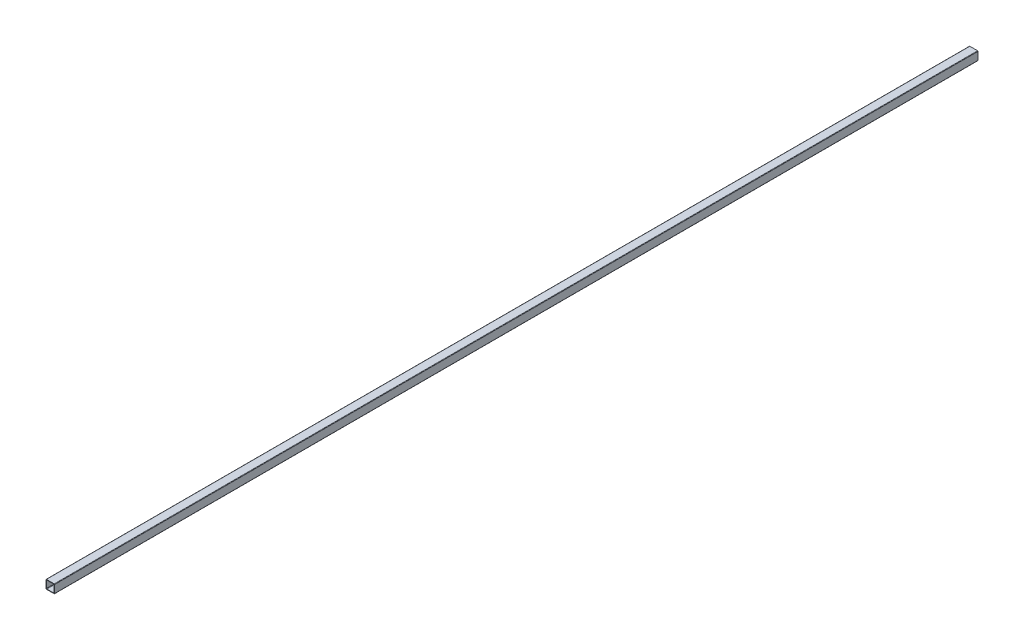
from build123d import *

# Parameters (mm, degrees)
EXTRUDE_1_DEPTH = 4300


with BuildPart() as part:
    # Эскиз1 → Бобышка-Вытянуть1 (new body)
    with BuildSketch(Plane.XY):
        with BuildLine():
            Line((18, -20), (-18, -20))
            ThreePointArc((-18, -20), (-19.414213562, -19.414213562), (-20, -18))
            Line((-20, -18), (-20, 18))
            ThreePointArc((-20, 18), (-19.414213562, 19.414213562), (-18, 20))
            Line((-18, 20), (18, 20))
            ThreePointArc((18, 20), (19.414213562, 19.414213562), (20, 18))
            Line((20, 18), (20, -18))
            ThreePointArc((20, -18), (19.414213562, -19.414213562), (18, -20))
        make_face()
        with BuildLine():
            Line((16, -18), (-16, -18))
            ThreePointArc((-16, -18), (-17.414213562, -17.414213562), (-18, -16))
            Line((-18, -16), (-18, 16))
            ThreePointArc((-18, 16), (-17.414213562, 17.414213562), (-16, 18))
            Line((-16, 18), (16, 18))
            ThreePointArc((16, 18), (17.414213562, 17.414213562), (18, 16))
            Line((18, 16), (18, -16))
            ThreePointArc((18, -16), (17.414213562, -17.414213562), (16, -18))
        make_face(mode=Mode.SUBTRACT)
    extrude(amount=EXTRUDE_1_DEPTH)


solid = part.part
